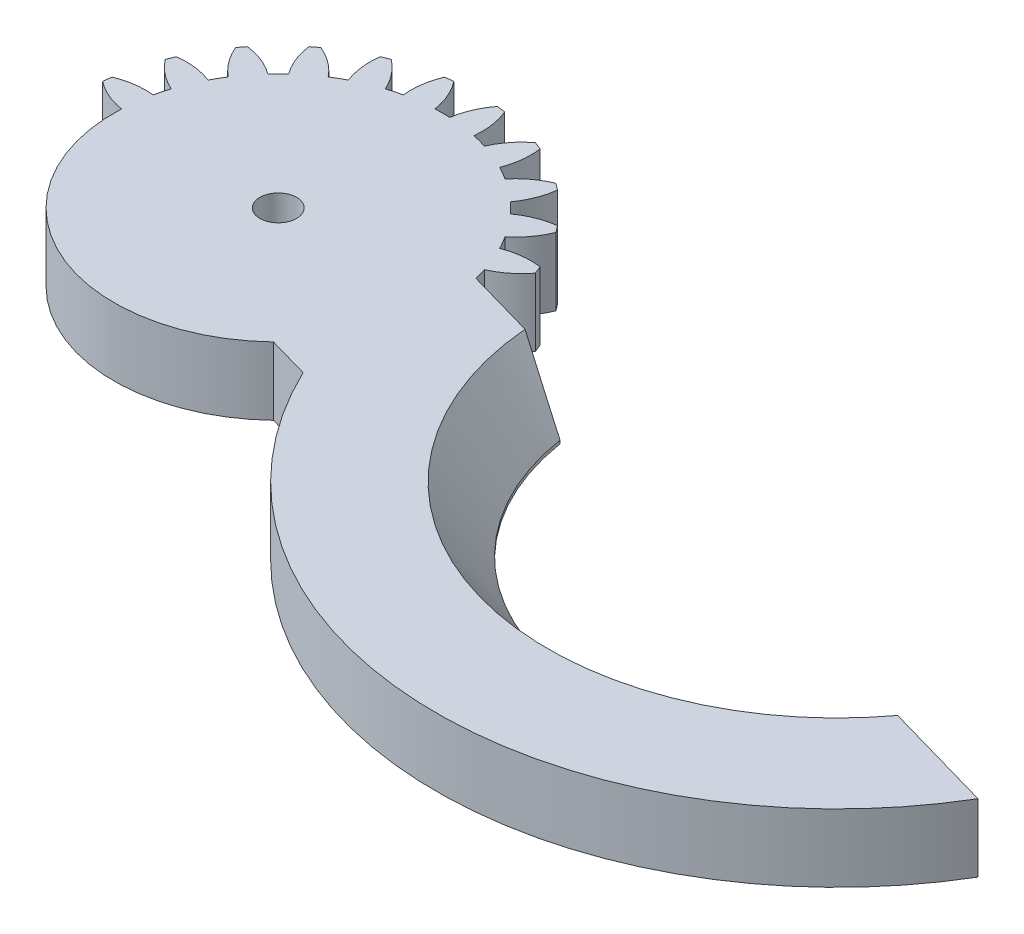
from build123d import *

# Parameters (mm, degrees)
BOSS_EXTRUDE1_DEPTH = 5
SKETCH_1_R          = 1.35
CUT_EXTRUDE_1_DEPTH = 30.045539702
SKETCH_2_R          = 4.265
SKETCH_2_R_2        = 2.265
EXTRUDE_1_DEPTH     = 3
EXTRUDE_2_DEPTH     = 5


with BuildPart() as part:
    # Sketch1 → Boss-Extrude1 (new body)
    with BuildSketch(Plane(origin=(0, 4, 0), x_dir=(1, 0, 0), z_dir=(0, 1, 0))):
        with BuildLine():
            ThreePointArc((-24.562186363, 2.217928037), (-24.606223651, 1.908945561), (-24.643657446, 1.599093719))
            ThreePointArc((-24.643657446, 1.599093719), (-23.481710119, 0.916420874), (-22.186907731, 0.542722358))
            ThreePointArc((-22.186907731, 0.542722358), (-12.402167869, -11.872817218), (1.305695063, -4))
            ThreePointArc((1.305695063, -4), (1.985007572, -0.183996455), (1.422120465, 3.650909885))
            ThreePointArc((1.422120465, 3.650909885), (1.757918397, 3.814049117), (2.081641936, 4))
            ThreePointArc((2.081641936, 4), (2.861028333, 4.588201733), (3.521749436, 5.30713988))
            ThreePointArc((3.521749436, 5.30713988), (3.405395609, 5.596745198), (3.282888305, 5.883801663))
            ThreePointArc((3.282888305, 5.883801663), (1.93527598, 5.894040025), (0.627094961, 5.57027124))
            ThreePointArc((0.627094961, 5.57027124), (0.366286148, 6.046375), (0.084372603, 6.510293938))
            ThreePointArc((0.084372603, 6.510293938), (1.018855105, 7.48132754), (1.683794586, 8.65351323))
            ThreePointArc((1.683794586, 8.65351323), (1.496450048, 8.903135899), (1.303821399, 9.148703928))
            ThreePointArc((1.303821399, 9.148703928), (-0.000522033, 8.809805691), (-1.180330337, 8.158486898))
            ThreePointArc((-1.180330337, 8.158486898), (-1.555477026, 8.550865528), (-1.947855656, 8.926012217))
            ThreePointArc((-1.947855656, 8.926012217), (-1.296536862, 10.105820521), (-0.957638625, 11.410163953))
            ThreePointArc((-0.957638625, 11.410163953), (-1.203206655, 11.602792602), (-1.452829324, 11.79013714))
            ThreePointArc((-1.452829324, 11.79013714), (-2.625015014, 11.125197659), (-3.596048616, 10.190715157))
            ThreePointArc((-3.596048616, 10.190715157), (-4.059967554, 10.472628702), (-4.536071314, 10.733437515))
            ThreePointArc((-4.536071314, 10.733437515), (-4.212302529, 12.041618533), (-4.222540891, 13.389230859))
            ThreePointArc((-4.222540891, 13.389230859), (-4.509597355, 13.511738163), (-4.799202674, 13.62809199))
            ThreePointArc((-4.799202674, 13.62809199), (-5.759348103, 12.682425791), (-6.455432668, 11.528463019))
            ThreePointArc((-6.455432668, 11.528463019), (-6.976508546, 11.680699536), (-7.503891752, 11.809396783))
            ThreePointArc((-7.503891752, 11.809396783), (-7.529737283, 13.156800143), (-7.888414517, 14.455843809))
            ThreePointArc((-7.888414517, 14.455843809), (-8.197396993, 14.499881098), (-8.507248835, 14.537314892))
            ThreePointArc((-8.507248835, 14.537314892), (-9.18992168, 13.375367565), (-9.563620196, 12.080565177))
            ThreePointArc((-9.563620196, 12.080565177), (-10.106342554, 12.09275), (-10.649064912, 12.080565177))
            ThreePointArc((-10.649064912, 12.080565177), (-11.022763428, 13.375367565), (-11.705436272, 14.537314892))
            ThreePointArc((-11.705436272, 14.537314892), (-12.015288115, 14.499881098), (-12.324270591, 14.455843809))
            ThreePointArc((-12.324270591, 14.455843809), (-12.682947825, 13.156800143), (-12.708793355, 11.809396783))
            ThreePointArc((-12.708793355, 11.809396783), (-13.236176561, 11.680699536), (-13.757252439, 11.528463019))
            ThreePointArc((-13.757252439, 11.528463019), (-14.453337005, 12.682425791), (-15.413482434, 13.62809199))
            ThreePointArc((-15.413482434, 13.62809199), (-15.703087752, 13.511738163), (-15.990144217, 13.389230859))
            ThreePointArc((-15.990144217, 13.389230859), (-16.000382579, 12.041618533), (-15.676613793, 10.733437515))
            ThreePointArc((-15.676613793, 10.733437515), (-16.152717554, 10.472628702), (-16.616636492, 10.190715157))
            ThreePointArc((-16.616636492, 10.190715157), (-17.587670094, 11.125197659), (-18.759855783, 11.79013714))
            ThreePointArc((-18.759855783, 11.79013714), (-19.009478453, 11.602792602), (-19.255046482, 11.410163953))
            ThreePointArc((-19.255046482, 11.410163953), (-18.916148245, 10.105820521), (-18.264829452, 8.926012217))
            ThreePointArc((-18.264829452, 8.926012217), (-18.657208082, 8.550865528), (-19.032354771, 8.158486898))
            ThreePointArc((-19.032354771, 8.158486898), (-20.212163074, 8.809805691), (-21.516506507, 9.148703928))
            ThreePointArc((-21.516506507, 9.148703928), (-21.709135156, 8.903135899), (-21.896479694, 8.65351323))
            ThreePointArc((-21.896479694, 8.65351323), (-21.231540213, 7.48132754), (-20.297057711, 6.510293938))
            ThreePointArc((-20.297057711, 6.510293938), (-20.578971255, 6.046375), (-20.839780068, 5.57027124))
            ThreePointArc((-20.839780068, 5.57027124), (-22.147961087, 5.894040025), (-23.495573413, 5.883801663))
            ThreePointArc((-23.495573413, 5.883801663), (-23.618080717, 5.596745198), (-23.734434544, 5.30713988))
            ThreePointArc((-23.734434544, 5.30713988), (-22.788768345, 4.346994451), (-21.634805572, 3.650909885))
            ThreePointArc((-21.634805572, 3.650909885), (-21.78704209, 3.129834008), (-21.915739337, 2.602450802))
            ThreePointArc((-21.915739337, 2.602450802), (-23.263142697, 2.576605271), (-24.562186363, 2.217928037))
        make_face()
    extrude(amount=-BOSS_EXTRUDE1_DEPTH)

    # 草图1 → 切除-拉伸1 (cut, through all)
    with BuildSketch(Plane.XZ.offset(1)):
        with Locations(Location((-10.106342554, 0, 0), (0, 0, 270))):
            Circle(SKETCH_1_R)
    extrude(amount=-CUT_EXTRUDE_1_DEPTH, mode=Mode.SUBTRACT)

    # 草图2 → 凸台-拉伸1 (add)
    with BuildSketch(Plane.XZ.offset(1)):
        with Locations(Location((-10.106342554, 0, 0), (0, 0, 90))):
            Circle(SKETCH_2_R)
        with Locations(Location((-10.106342554, 0, 0), (0, 0, 270))):
            Circle(SKETCH_2_R_2, mode=Mode.SUBTRACT)
    extrude(amount=EXTRUDE_1_DEPTH)

    # 草图3 → 凸台-拉伸2 (add)
    with BuildSketch(Plane.XZ.offset(1)):
        with BuildLine():
            Line((1.316832407, 9.59169813), (-1.732440783, 8.724240465))
            Line((-1.732440783, 8.724240465), (1.660979616, -2.786526782))
            Line((1.660979616, -2.786526782), (10.317511543, -0.323915364))
            ThreePointArc((10.317511543, -0.323915364), (23.060971172, 14.056333138), (41.465450985, 8.537054824))
            Line((41.465450985, 8.537054824), (53.333346557, 11.913235424))
            ThreePointArc((53.333346557, 11.913235424), (26.628358933, 26.363456331), (1.316832407, 9.59169813))
        make_face()
    extrude(amount=-EXTRUDE_2_DEPTH)

    # 草图5 → 切除-旋转1 (revolve, cut)
    with BuildSketch(Plane(origin=(8.606089679, 0, -14.547237495), x_dir=(-0.8606674274779063, 0, -0.5091675355701334), z_dir=(0.5091675355701334, 0, -0.8606674274779063))):
        Polygon((-43.768106901, 4), (-39.968106901, -1.23415978), (-39.968106901, 4), align=None)
    revolve(axis=Axis((27.943657446, -0.047851862, -3.107206875), (0, -1, 0)), mode=Mode.SUBTRACT)


solid = part.part
